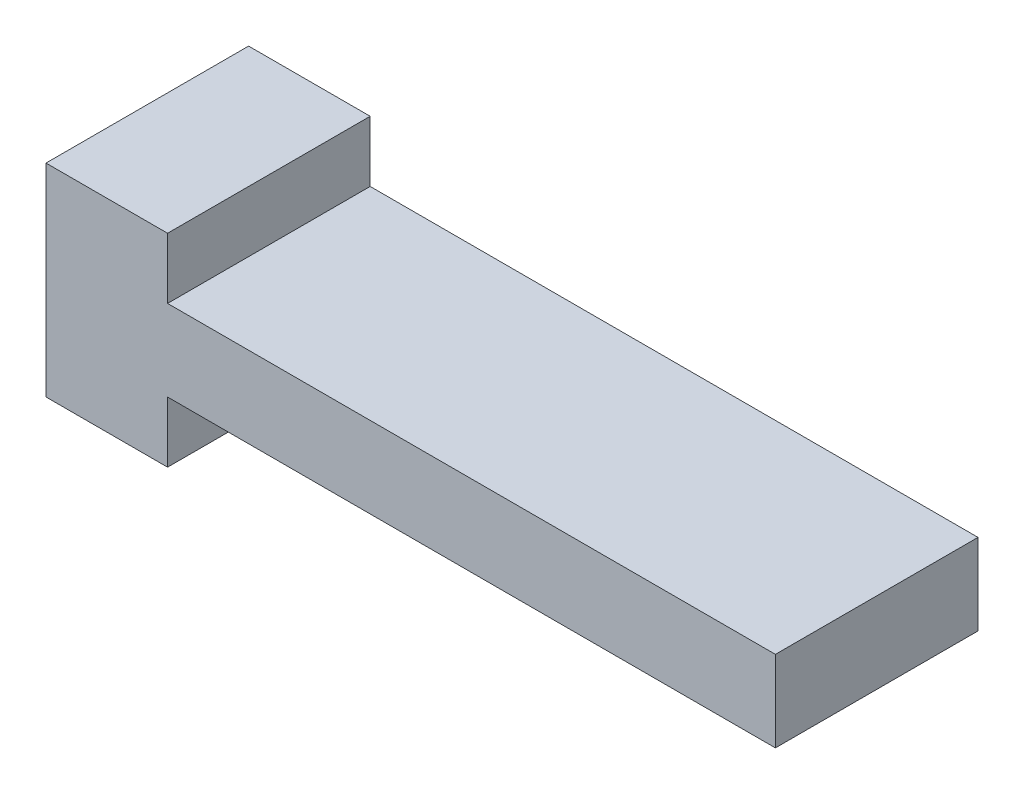
from build123d import *

# Parameters (mm, degrees)
BOSS_EXTRUDE1_DEPTH = 50


with BuildPart() as part:
    # Sketch1 → Boss-Extrude1 (new body)
    with BuildSketch(Plane.XY):
        Polygon((0, 25), (0, -25), (30, -25), (30, -10), (180, -10), (180, 10), (30, 10), (30, 25), align=None)
    extrude(amount=BOSS_EXTRUDE1_DEPTH)


solid = part.part
